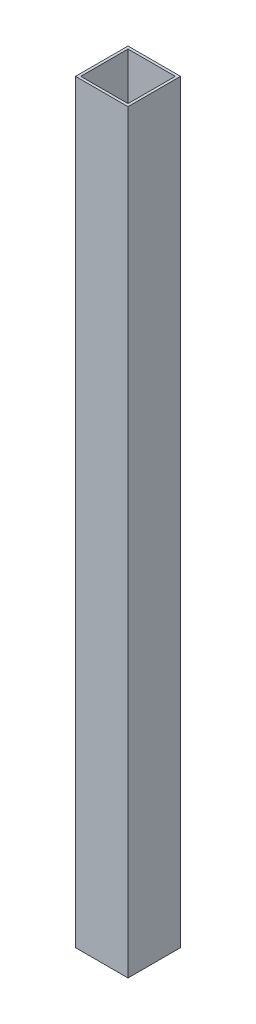
from build123d import *

# Parameters (mm, degrees)
SKETCH1_W           = 20
SKETCH1_H           = 20
SKETCH1_W_2         = 18
SKETCH1_H_2         = 18
BOSS_EXTRUDE1_DEPTH = 287.33


with BuildPart() as part:
    # Sketch1 → Boss-Extrude1 (new body)
    with BuildSketch(Plane(origin=(0, 0, 0), x_dir=(1, 0, 0), z_dir=(0, 1, 0))):
        Rectangle(SKETCH1_W, SKETCH1_H)
        Rectangle(SKETCH1_W_2, SKETCH1_H_2, mode=Mode.SUBTRACT)
    extrude(amount=BOSS_EXTRUDE1_DEPTH)


solid = part.part
